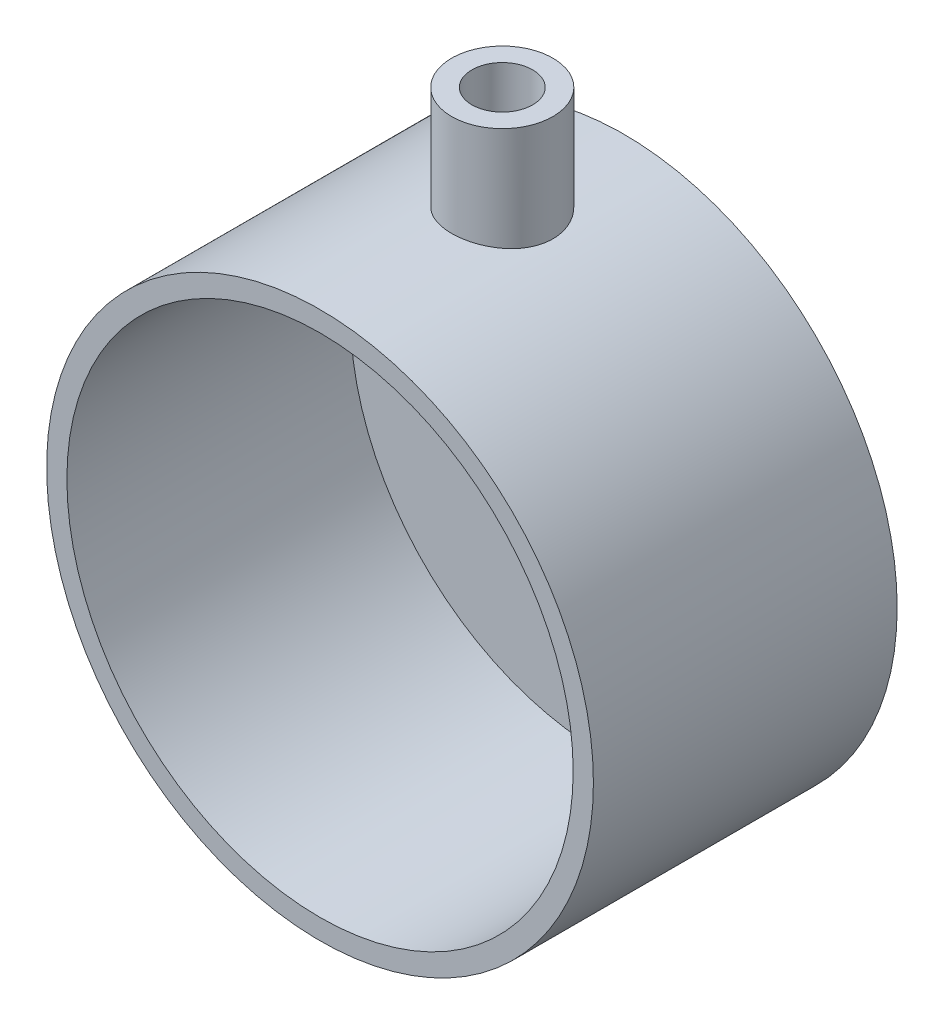
from build123d import *

# Parameters (mm, degrees)
SKETCH_1_R           = 27
EXTRUDE_1_DEPTH      = 2
SKETCH_2_R           = 27
SKETCH_2_R_2         = 25
EXTRUDE_2_DEPTH      = 30
SKETCH_3_R           = 2.5
CUT_EXTRUDE_1_DEPTH  = 15
EXTRUDE_3_DEPTH      = 10
EXTRUDE_3_DEPTH_BACK = 2
SKETCH_4_R           = 5
SKETCH_5_R           = 3
CUT_EXTRUDE_2_DEPTH  = 50


with BuildPart() as part:
    # 草图1 → 凸台-拉伸1 (new body)
    with BuildSketch(Plane.XY):
        Circle(SKETCH_1_R)
    extrude(amount=EXTRUDE_1_DEPTH)

    # 草图2 → 凸台-拉伸2 (add)
    with BuildSketch(Plane.XY):
        Circle(SKETCH_2_R)
        Circle(SKETCH_2_R_2, mode=Mode.SUBTRACT)
    extrude(amount=EXTRUDE_2_DEPTH)

    # 草图3 → 切除-拉伸1 (cut, symmetric)
    with BuildSketch(Plane.XY):
        Circle(SKETCH_3_R)
    extrude(amount=CUT_EXTRUDE_1_DEPTH, both=True, mode=Mode.SUBTRACT)

    # 草图4 → 凸台-拉伸3 (add, two sides: drawn at the far end of the back side and taken through both)
    with BuildSketch(Plane(origin=(0, 27, 0), x_dir=(1, 0, 0), z_dir=(0, 1, 0)).offset(-EXTRUDE_3_DEPTH_BACK)):
        with Locations(Location((0, -12, 0), (0, 0, 270))):
            Circle(SKETCH_4_R)
    extrude(amount=EXTRUDE_3_DEPTH + EXTRUDE_3_DEPTH_BACK)

    # 草图5 → 切除-拉伸2 (cut)
    with BuildSketch(Plane(origin=(0, 37, 0), x_dir=(1, 0, 0), z_dir=(0, 1, 0))):
        with Locations(Location((0, -12, 0), (0, 0, 270))):
            Circle(SKETCH_5_R)
    extrude(amount=-CUT_EXTRUDE_2_DEPTH, mode=Mode.SUBTRACT)


solid = part.part
